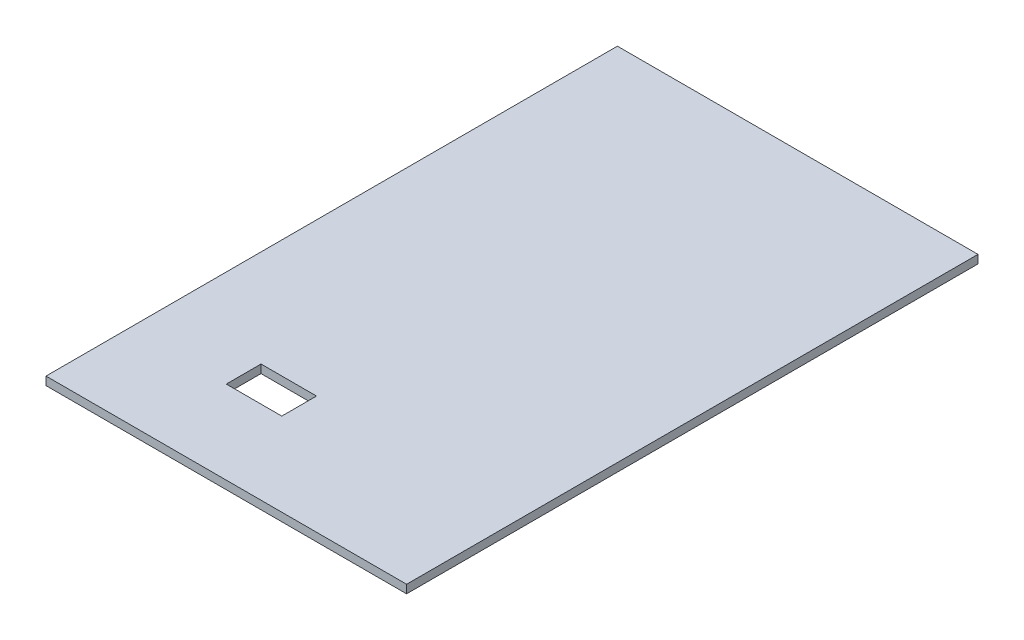
from build123d import *

# Parameters (mm, degrees)
SKETCH1_W           = 130
SKETCH1_H           = 206
BOSS_EXTRUDE1_DEPTH = 3
SKETCH3_W           = 20
SKETCH3_H           = 12.52
CUT_EXTRUDE1_DEPTH  = 4


with BuildPart() as part:
    # Sketch1 → Boss-Extrude1 (new body)
    with BuildSketch(Plane(origin=(0, 0, 0), x_dir=(1, 0, 0), z_dir=(0, 1, 0))):
        Rectangle(SKETCH1_W, SKETCH1_H)
    extrude(amount=BOSS_EXTRUDE1_DEPTH)

    # Sketch3 → Cut-Extrude1 (cut)
    with BuildSketch(Plane(origin=(0, 3, 0), x_dir=(1, 0, 0), z_dir=(0, 1, 0))):
        with Locations((-20, -66.74)):
            Rectangle(SKETCH3_W, SKETCH3_H)
    extrude(amount=-CUT_EXTRUDE1_DEPTH, mode=Mode.SUBTRACT)


solid = part.part
